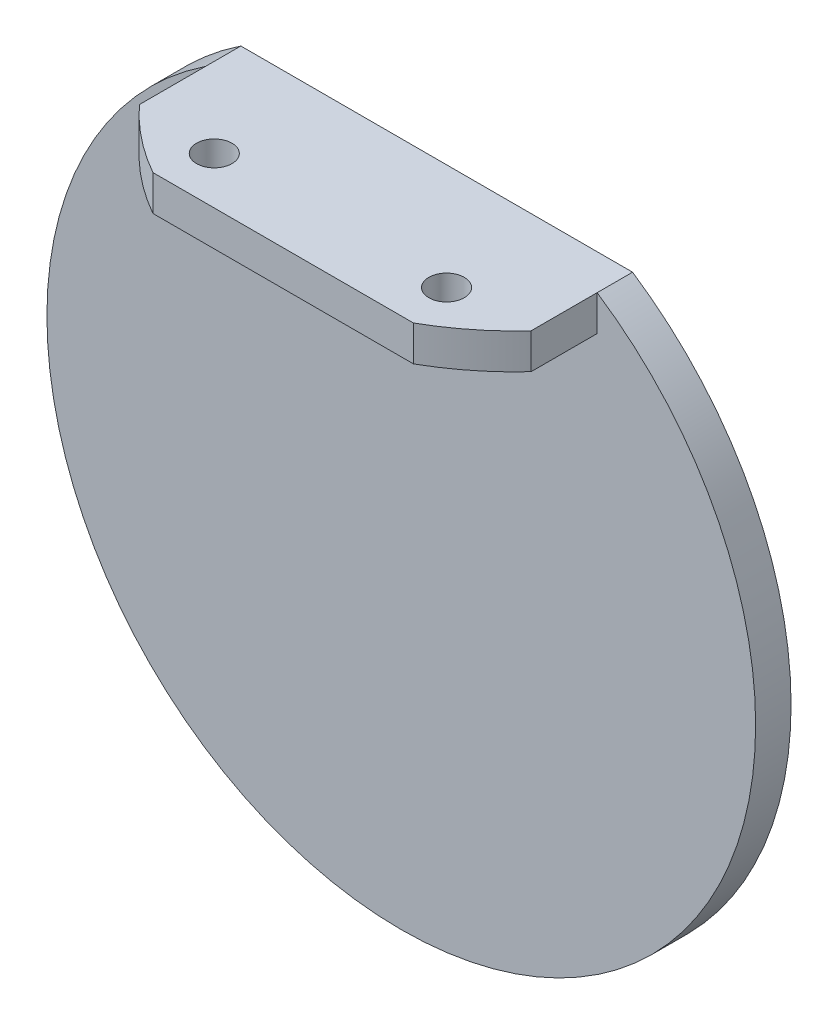
from build123d import *

# Parameters (mm, degrees)
BOSS_EXTRU_1_DEPTH      = 3
BOSS_EXTRU_2_START      = -3
ESQUISSE2_W             = 33.166247904
ESQUISSE2_H             = 3
BOSS_EXTRU_2_DEPTH      = 10
ENL_V_MAT_EXTRU_1_DEPTH = 64.984373092
ESQUISSE4_R             = 1.5
ENL_V_MAT_EXTRU_2_DEPTH = 62.424750712


with BuildPart() as part:
    # Esquisse1 → Boss.-Extru.1 (new body)
    with BuildSketch(Plane.XY):
        with BuildLine():
            Line((16.583123952, 25), (-16.583123952, 25))
            ThreePointArc((-16.583123952, 25), (-14.186371655, -26.433820369), (30, 0))
            ThreePointArc((30, 0), (26.433820369, 14.186371655), (16.583123952, 25))
        make_face()
    extrude(amount=BOSS_EXTRU_1_DEPTH)

    # Esquisse2 → Boss.-Extru.2 (add)
    with BuildSketch(Plane(origin=(0, 0, 0), x_dir=(-1, 0, 0), z_dir=(0, 0, -1)).offset(BOSS_EXTRU_2_START)):
        with Locations((0, 23.5)):
            Rectangle(ESQUISSE2_W, ESQUISSE2_H)
    extrude(amount=-BOSS_EXTRU_2_DEPTH)

    # Esquisse3 → Enlèv. mat.-Extru.1 (cut, through all)
    with BuildSketch(Plane(origin=(0, 25, 0), x_dir=(1, 0, 0), z_dir=(0, 1, 0))):
        with BuildLine():
            Line((11.024660406, -13), (16.583123952, -13))
            Line((16.583123952, -13), (16.583123952, -8.593951902))
            ThreePointArc((16.583123952, -8.593951902), (13.978605431, -11.017385992), (11.024660406, -13))
        make_face()
        with BuildLine():
            Line((-16.583123952, -8.589860243), (-16.583123952, -13))
            Line((-16.583123952, -13), (-11.02090831, -13))
            ThreePointArc((-11.02090831, -13), (-13.977028503, -11.015661574), (-16.583123952, -8.589860243))
        make_face()
    extrude(amount=-ENL_V_MAT_EXTRU_1_DEPTH, mode=Mode.SUBTRACT)

    # Esquisse4 → Enlèv. mat.-Extru.2 (cut, through all)
    with BuildSketch(Plane.XZ.offset(-22)):
        with Locations(Location((-9.833123952, 9, 0), (0, 0, 270))):
            Circle(ESQUISSE4_R)
        with Locations(Location((9.833123952, 9, 0), (0, 0, 90))):
            Circle(ESQUISSE4_R)
    extrude(amount=-ENL_V_MAT_EXTRU_2_DEPTH, mode=Mode.SUBTRACT)


solid = part.part
